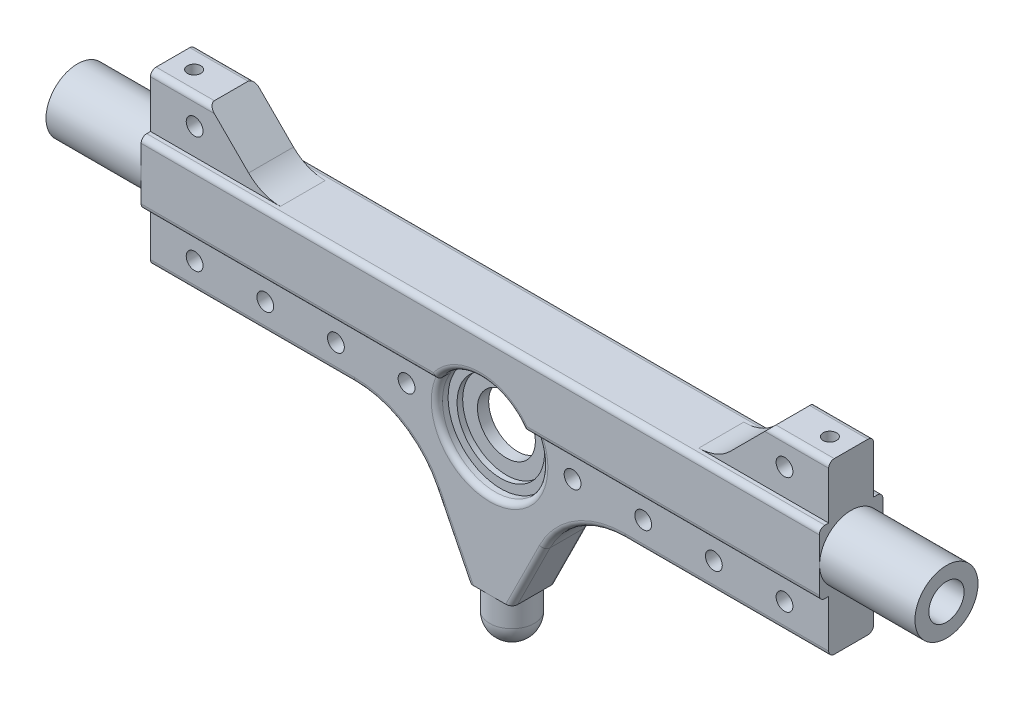
from build123d import *

# Parameters (mm, degrees)
SKETCH2_W           = 18
SKETCH2_H           = 18
BOSS_EXTRUDE2_DEPTH = 130
BOSS_EXTRUDE3_DEPTH = 6.35
SKETCH7_R           = 18
SKETCH7_R_2         = 8.9296875
CUT_EXTRUDE1_DEPTH  = 34
CUT_EXTRUDE2_START  = -34
SKETCH8_R           = 15
SKETCH8_R_2         = 8.9296875
CUT_EXTRUDE2_DEPTH  = 34
SKETCH11_W          = 73.448818898
SKETCH11_H          = 15
BOSS_EXTRUDE6_DEPTH = 12.7
SKETCH13_R          = 2.38125
CUT_EXTRUDE3_DEPTH  = 14.27
FILLET4_R           = 25.4
SKETCH6_R           = 5
CUT_EXTRUDE4_DEPTH  = 42
SKETCH14_R          = 3.96875
CUT_EXTRUDE5_DEPTH  = 22
CUT_EXTRUDE6_START  = -7
SKETCH15_R          = 8.9296875
SKETCH15_R_2        = 5
CUT_EXTRUDE6_DEPTH  = 7
SKETCH16_R          = 1.905
CUT_EXTRUDE7_DEPTH  = 139.87044322
FILLET5_R           = 12.7
FILLET7_R           = 1.5875
FILLET8_R           = 1.5875


with BuildPart() as part:
    # Sketch2 → Boss-Extrude2 (new, symmetric)
    with BuildSketch(Plane(origin=(0, 0, 0), x_dir=(0, 0, -1), z_dir=(1, 0, 0))):
        with Locations((0, 9)):
            Rectangle(SKETCH2_W, SKETCH2_H)
    extrude(amount=BOSS_EXTRUDE2_DEPTH, both=True)

    # Sketch3 → Boss-Extrude3 (add, symmetric)
    with BuildSketch(Plane.XY):
        Polygon((-6.35, -47.625), (6.35, -47.625), (30, 0), (-30, 0), align=None)
    extrude(amount=BOSS_EXTRUDE3_DEPTH, both=True)

    # Sketch4 → Cut-Revolve1 (revolve, cut)
    with BuildSketch(Plane(origin=(0, -8.255, 0), x_dir=(-1, 0, 0), z_dir=(0, -1, 0))):
        Polygon((10.153399538, 1.5875), (11.6205, 1.5875), (12.3825, 1.5875), (12.3825, 1.778), (12.3825, 2.667), (12.3825, 3.175), (12.6365, 3.175), (14.1605, 3.175), (14.9225, 3.175), (14.9225, 3.683), (14.9225, 9.0424), (0, 9.0424), (0, -9.0424), (14.9225, -9.0424), (14.9225, -3.683), (14.9225, -3.175), (14.1605, -3.175), (12.6365, -3.175), (12.3825, -3.175), (12.3825, -2.667), (12.3825, -1.778), (12.3825, -1.5875), (11.6205, -1.5875), (10.153399538, -1.5875), (8.1915, -1.5875), (8.1915, 1.5875), align=None)
    revolve(axis=Axis((0, -8.255, -9.0424), (0, 0, 1)), mode=Mode.SUBTRACT)

    # Sketch7 → Cut-Extrude1 (cut)
    with BuildSketch(Plane.ZY.offset(130)):
        with Locations((0, 9)):
            Circle(SKETCH7_R)
        with Locations((0, 9)):
            Circle(SKETCH7_R_2, mode=Mode.SUBTRACT)
    extrude(amount=-CUT_EXTRUDE1_DEPTH, mode=Mode.SUBTRACT)

    # Sketch8 → Cut-Extrude2 (cut)
    with BuildSketch(Plane(origin=(130, 0, 0), x_dir=(0, 0, -1), z_dir=(1, 0, 0)).offset(CUT_EXTRUDE2_START)):
        with Locations((0, 9)):
            Circle(SKETCH8_R)
        with Locations(Location((0, 9, 0), (0, 0, 180))):
            Circle(SKETCH8_R_2, mode=Mode.SUBTRACT)
    extrude(amount=CUT_EXTRUDE2_DEPTH, mode=Mode.SUBTRACT)

    # Sketch11 → Boss-Extrude6 (add)
    with BuildSketch(Plane.XY.offset(6.35)):
        with Locations((-59.275590551, -7.5)):
            Rectangle(SKETCH11_W, SKETCH11_H)
        Polygon((-96, 33), (-96, 18), (-64.5, 18), (-79.5, 33), align=None)
        with Locations((59.275590551, -7.5)):
            Rectangle(SKETCH11_W, SKETCH11_H)
        Polygon((64.5, 18), (96, 18), (96, 33), (79.5, 33), align=None)
    extrude(amount=-BOSS_EXTRUDE6_DEPTH)

    # Sketch12 → Revolve2 (revolve)
    with BuildSketch(Plane.XY):
        with BuildLine():
            Line((0, -47.625), (6.35, -47.625))
            Line((6.35, -47.625), (6.35, -54.61))
            ThreePointArc((6.35, -54.61), (4.490128061, -59.100128061), (0, -60.96))
            Line((0, -60.96), (0, -47.625))
        make_face()
    revolve(axis=Axis((0, -54.61, 0), (0, -1, 0)))

    # Sketch13 → Cut-Extrude3 (cut)
    with BuildSketch(Plane.XY.offset(6.35)):
        with Locations((83.5, -7.5)):
            Circle(SKETCH13_R)
        with Locations((63.5, -7.5)):
            Circle(SKETCH13_R)
        with Locations((43.5, -7.5)):
            Circle(SKETCH13_R)
        with Locations((23.5, -7.5)):
            Circle(SKETCH13_R)
        with Locations((-83.5, -7.5)):
            Circle(SKETCH13_R)
        with Locations((-63.5, -7.5)):
            Circle(SKETCH13_R)
        with Locations((-43.5, -7.5)):
            Circle(SKETCH13_R)
        with Locations((-23.5, -7.5)):
            Circle(SKETCH13_R)
        with Locations((-83.5, 25.5)):
            Circle(SKETCH13_R)
        with Locations((83.5, 25.5)):
            Circle(SKETCH13_R)
    extrude(amount=-CUT_EXTRUDE3_DEPTH, mode=Mode.SUBTRACT)

    # Fillet4
    fillet4_edges = [part.edges().sort_by_distance(p)[0] for p in [
        (22.551181102, -15, 0),
        (-22.551181102, -15, 0),
    ]]
    fillet(fillet4_edges, radius=FILLET4_R)

    # Sketch6 → Cut-Extrude4 (cut)
    with BuildSketch(Plane(origin=(130, 0, 0), x_dir=(0, 0, -1), z_dir=(1, 0, 0))):
        with Locations((0, 9)):
            Circle(SKETCH6_R)
    cut_extrude4 = extrude(amount=-CUT_EXTRUDE4_DEPTH, mode=Mode.SUBTRACT)

    # Sketch14 → Cut-Extrude5 (cut)
    with BuildSketch(Plane(origin=(88, 0, 0), x_dir=(0, 0, -1), z_dir=(1, 0, 0))):
        with Locations((0, 9)):
            Circle(SKETCH14_R)
    cut_extrude5 = extrude(amount=-CUT_EXTRUDE5_DEPTH, mode=Mode.SUBTRACT)

    # Sketch15 → Cut-Extrude6 (cut)
    with BuildSketch(Plane(origin=(130, 0, 0), x_dir=(0, 0, -1), z_dir=(1, 0, 0)).offset(CUT_EXTRUDE6_START)):
        with Locations((0, 9)):
            Circle(SKETCH15_R)
        with Locations((0, 9)):
            Circle(SKETCH15_R_2, mode=Mode.SUBTRACT)
    cut_extrude6 = extrude(amount=CUT_EXTRUDE6_DEPTH, mode=Mode.SUBTRACT)

    # Sketch16 → Cut-Extrude7 (cut, through all)
    with BuildSketch(Plane.XZ.offset(15)):
        with Locations((90, 0)):
            Circle(SKETCH16_R)
    cut_extrude7 = extrude(amount=-CUT_EXTRUDE7_DEPTH, mode=Mode.SUBTRACT)

    # Mirror1: Cut-Extrude4, Cut-Extrude5, Cut-Extrude6, Cut-Extrude7 across plane
    add(cut_extrude4.mirror(Plane.ZY), mode=Mode.SUBTRACT)
    add(cut_extrude5.mirror(Plane.ZY), mode=Mode.SUBTRACT)
    add(cut_extrude6.mirror(Plane.ZY), mode=Mode.SUBTRACT)
    add(cut_extrude7.mirror(Plane.ZY), mode=Mode.SUBTRACT)

    # Fillet5
    fillet5_edges = [part.edges().sort_by_distance(p)[0] for p in [
        (64.5, 18, 0),
        (-64.5, 18, 0),
    ]]
    fillet(fillet5_edges, radius=FILLET5_R)

    # Fillet7
    fillet7_edges = [part.edges().sort_by_distance(p)[0] for p in [
        (87.75, 33, -6.35),
        (87.75, 33, 6.35),
        (67.148629257, -15, 6.35),
        (67.148629257, -15, -6.35),
        (10.948921831, -38.363957625, -6.35),
        (10.948921831, -38.363957625, 6.35),
        (-10.948921831, -38.363957625, 6.35),
        (-10.948921831, -38.363957625, -6.35),
        (-24.914171289, -18.811739849, 6.35),
        (-24.914171289, -18.811739849, -6.35),
        (24.914171289, -18.811739849, 6.35),
        (24.914171289, -18.811739849, -6.35),
        (-67.148629257, -15, -6.35),
        (-67.148629257, -15, 6.35),
        (-87.75, 33, 6.35),
        (-87.75, 33, -6.35),
    ]]
    fillet(fillet7_edges, radius=FILLET7_R)

    # Fillet8
    fillet8_edges = [part.edges().sort_by_distance(p)[0] for p in [
        (54.215625094, 0, -9),
        (-54.215625094, 0, -9),
        (0, 18, -9),
        (-54.215625094, 0, 9),
        (54.215625094, 0, 9),
        (0, 18, 9),
        (0, 6.6675, 9),
        (4.311361462, -22.541118038, 6.35),
        (0, 6.6675, -9),
        (4.311361462, -22.541118038, -6.35),
    ]]
    fillet(fillet8_edges, radius=FILLET8_R)


solid = part.part
